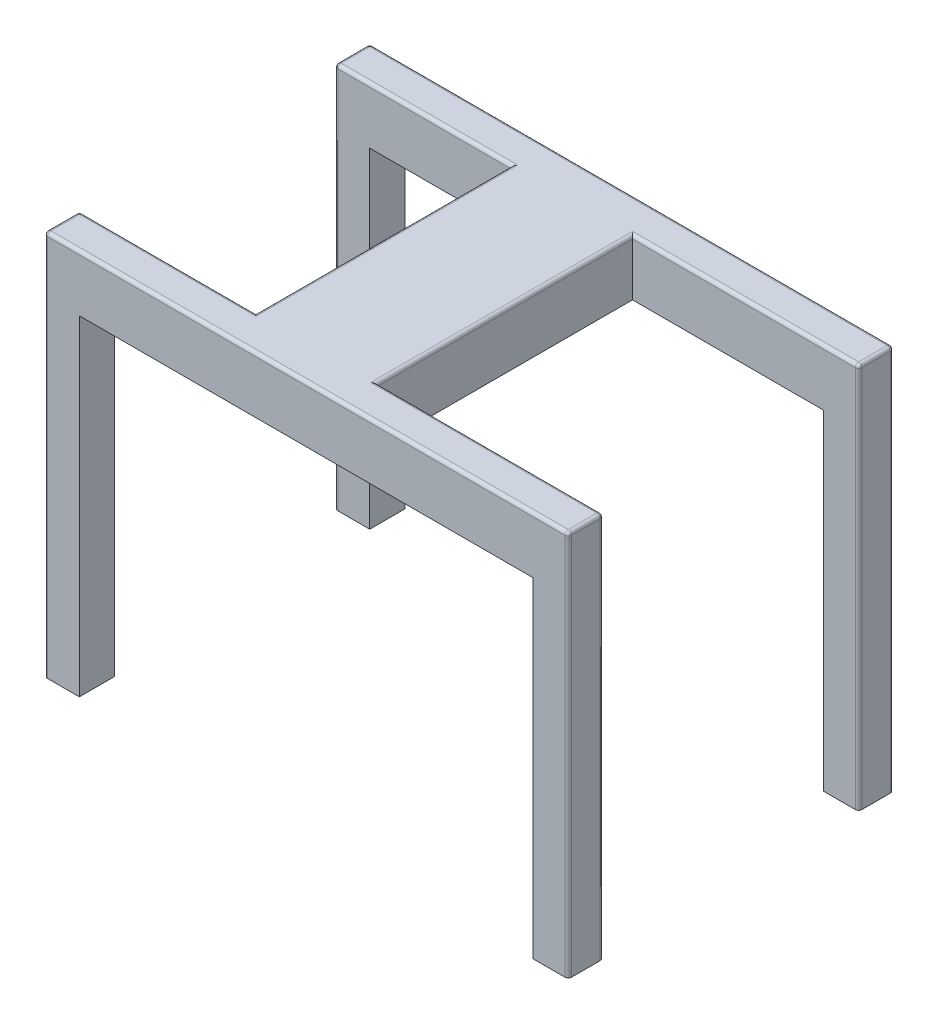
from build123d import *

# Parameters (mm, degrees)
SALIENTE_EXTRUIR1_DEPTH = 590
CROQUIS2_W              = 823.0000000000001
CROQUIS2_H              = 598.4
CORTAR_EXTRUIR1_DEPTH   = 1000
CORTAR_EXTRUIR2_DEPTH   = 1000
CORTAR_EXTRUIR3_DEPTH   = 200
REDONDEO1_R             = 6
REDONDEO2_R             = 6
REDONDEO3_R             = 6


with BuildPart() as part:
    # Croquis1 → Saliente-Extruir1 (new body)
    with BuildSketch(Plane.XY):
        Polygon((0, 0), (950, 0), (950.0000000000001, -700), (8.573e-14, -700), align=None)
    extrude(amount=SALIENTE_EXTRUIR1_DEPTH)

    # Croquis2 → Cortar-Extruir1 (cut)
    with BuildSketch(Plane.XY.offset(590)):
        with Locations((475.00000000000006, -400.8)):
            Rectangle(CROQUIS2_W, CROQUIS2_H)
    extrude(amount=-CORTAR_EXTRUIR1_DEPTH, mode=Mode.SUBTRACT)

    # Croquis3 → Cortar-Extruir2 (cut)
    with BuildSketch(Plane(origin=(950, 1.5067e-13, 0), x_dir=(0, 0, -1), z_dir=(1, 1.6e-16, 0))):
        Polygon((-526.5, -101.60000000000014), (-63.5, -101.60000000000014), (-63.499999999999886, -700.0000000000001), (-526.4999999999999, -700.0000000000001), align=None)
    extrude(amount=-CORTAR_EXTRUIR2_DEPTH, mode=Mode.SUBTRACT)

    # Croquis4 → Cortar-Extruir3 (cut)
    with BuildSketch(Plane(origin=(0, 0, 0), x_dir=(1, 0, 0), z_dir=(0, 1, 0))):
        Polygon((4.857e-14, -63.5), (320.00000000000006, -63.5), (320.0000000000001, -526.5), (5.67e-14, -526.5), align=None)
        Polygon((950, -63.5), (540, -63.50000000000004), (540.0000000000001, -526.4999999999999), (950.0000000000001, -526.4999999999999), align=None)
    extrude(amount=-CORTAR_EXTRUIR3_DEPTH, mode=Mode.SUBTRACT)

    # Redondeo1
    redondeo1_edges = [part.edges().sort_by_distance(p)[0] for p in [
        (0, 0, 31.75),
        (0, 0, 558.25),
        (950, 0, 558.25),
        (950, 0, 31.75),
    ]]
    fillet(redondeo1_edges, radius=REDONDEO1_R)

    # Redondeo2
    redondeo2_edges = [part.edges().sort_by_distance(p)[0] for p in [
        (320.0000000000001, 0, 295),
        (540, 0, 294.99999999999994),
    ]]
    fillet(redondeo2_edges, radius=REDONDEO2_R)

    # Redondeo3
    redondeo3_edges = [part.edges().sort_by_distance(p)[0] for p in [
        (950.0000000000001, -353, 590),
        (948.2426406871193, -1.7573593128807152, 590),
        (4.323e-14, -353, 590),
        (1.7573593128807161, -1.7573593128807143, 590),
        (950.0000000000001, -353, 0),
        (948.2426406871193, -1.7573593128807152, 0),
        (4.323e-14, -353, 0),
        (1.7573593128807161, -1.7573593128807143, 0),
        (950.0000000000001, -353, 526.4999999999999),
        (948.2426406871193, -1.7573593128807152, 526.4999999999999),
        (7.839e-14, -353, 526.4999999999999),
        (1.7573593128807161, -1.7573593128807143, 526.5),
        (7.436e-14, -353, 63.49999999999994),
        (1.7573593128807161, -1.7573593128807143, 63.5),
        (950.0000000000001, -353, 63.49999999999994),
        (948.2426406871193, -1.7573593128807152, 63.5),
        (475, 0, 590),
        (475, 0, 0),
        (739, 0, 526.4999999999999),
        (166.00000000000006, 4.4e-16, 526.5),
        (166.00000000000003, 4.4e-16, 63.5),
        (739, 0, 63.50000000000002),
    ]]
    fillet(redondeo3_edges, radius=REDONDEO3_R)


solid = part.part
